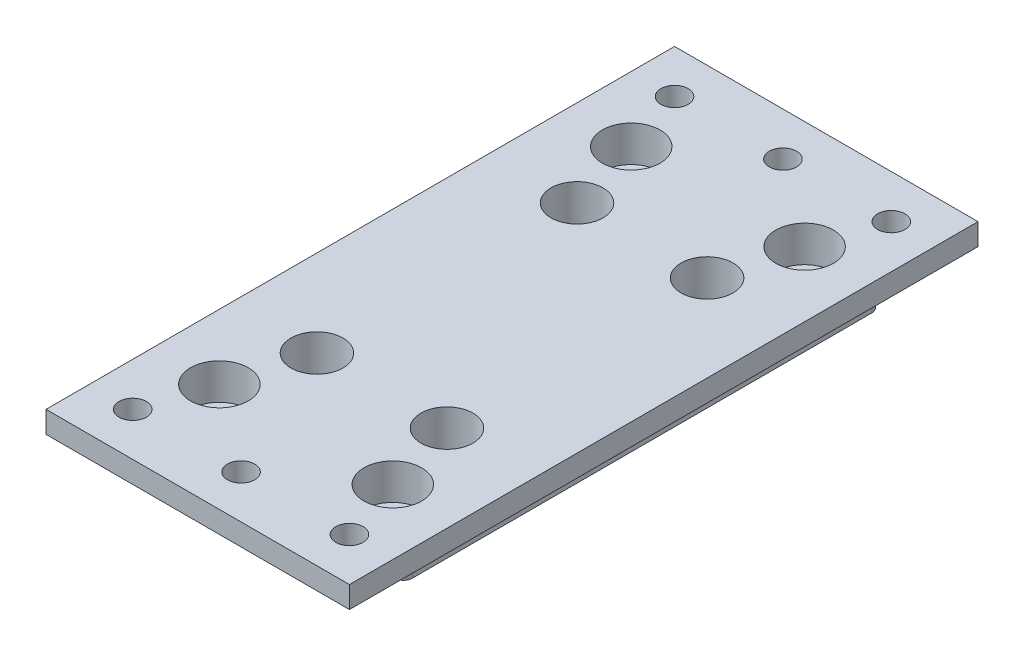
from build123d import *

# Parameters (mm, degrees)
SKETCH_1_R          = 4.1
SKETCH_1_R_2        = 6
EXTRUDE_1_DEPTH     = 11
SKETCH_2_R          = 6.65
CUT_EXTRUDE_1_DEPTH = 8.3
EXTRUDE_START       = -6
SKETCH_3_W          = 70
SKETCH_3_H          = 145
SKETCH_3_R          = 3.15
EXTRUDE_2_DEPTH     = 5


with BuildPart() as part:
    # 草图1 → 凸台-拉伸1 (new body)
    with BuildSketch(Plane(origin=(0, 0, 0), x_dir=(1, 0, 0), z_dir=(0, 1, 0))):
        with BuildLine():
            Line((-28, -55), (28, -55))
            ThreePointArc((28, -55), (29.414213562, -54.414213562), (30, -53))
            Line((30, -53), (30, 53))
            ThreePointArc((30, 53), (29.414213562, 54.414213562), (28, 55))
            Line((28, 55), (-28, 55))
            ThreePointArc((-28, 55), (-29.414213562, 54.414213562), (-30, 53))
            Line((-30, 53), (-30, -53))
            ThreePointArc((-30, -53), (-29.414213562, -54.414213562), (-28, -55))
        make_face()
        with Locations(Location((-20, 47.5, 0), (0, 0, 270))):
            Circle(SKETCH_1_R, mode=Mode.SUBTRACT)
        with Locations(Location((20, 47.5, 0), (0, 0, 90))):
            Circle(SKETCH_1_R, mode=Mode.SUBTRACT)
        with Locations(Location((-20, -47.5, 0), (0, 0, 90))):
            Circle(SKETCH_1_R, mode=Mode.SUBTRACT)
        with Locations(Location((20, -47.5, 0), (0, 0, 270))):
            Circle(SKETCH_1_R, mode=Mode.SUBTRACT)
        with Locations(Location((-15, 30, 0), (0, 0, 270))):
            Circle(SKETCH_1_R_2, mode=Mode.SUBTRACT)
        with Locations(Location((15, 30, 0), (0, 0, 90))):
            Circle(SKETCH_1_R_2, mode=Mode.SUBTRACT)
        with Locations(Location((15, -30, 0), (0, 0, 270))):
            Circle(SKETCH_1_R_2, mode=Mode.SUBTRACT)
        with Locations(Location((-15, -30, 0), (0, 0, 90))):
            Circle(SKETCH_1_R_2, mode=Mode.SUBTRACT)
    extrude(amount=EXTRUDE_1_DEPTH)

    # 草图2 → 切除-拉伸1 (cut)
    with BuildSketch(Plane(origin=(0, 11, 0), x_dir=(1, 0, 0), z_dir=(0, 1, 0))):
        with Locations(Location((-20, 47.5, 0), (0, 0, 270))):
            Circle(SKETCH_2_R)
        with Locations(Location((-20, -47.5, 0), (0, 0, 270))):
            Circle(SKETCH_2_R)
        with Locations(Location((20, 47.5, 0), (0, 0, 270))):
            Circle(SKETCH_2_R)
        with Locations(Location((20, -47.5, 0), (0, 0, 270))):
            Circle(SKETCH_2_R)
    extrude(amount=-CUT_EXTRUDE_1_DEPTH, mode=Mode.SUBTRACT)

    # 草图3 → 凸台-拉伸2 (add)
    with BuildSketch(Plane.XZ.offset(EXTRUDE_START)):
        Rectangle(SKETCH_3_W, SKETCH_3_H)
        with Locations(Location((-25, 62.5, 0), (0, 0, 270))):
            Circle(SKETCH_3_R, mode=Mode.SUBTRACT)
        with Locations(Location((25, 62.5, 0), (0, 0, 270))):
            Circle(SKETCH_3_R, mode=Mode.SUBTRACT)
        with Locations(Location((25, -62.5, 0), (0, 0, 270))):
            Circle(SKETCH_3_R, mode=Mode.SUBTRACT)
        with Locations(Location((-25, -62.5, 0), (0, 0, 270))):
            Circle(SKETCH_3_R, mode=Mode.SUBTRACT)
        with Locations(Location((0, 62.5, 0), (0, 0, 270))):
            Circle(SKETCH_3_R, mode=Mode.SUBTRACT)
        with Locations(Location((0, -62.5, 0), (0, 0, 270))):
            Circle(SKETCH_3_R, mode=Mode.SUBTRACT)
        with BuildLine():
            Line((-30, 53), (-30, -53))
            ThreePointArc((-30, -53), (-29.414213562, -54.414213562), (-28, -55))
            Line((-28, -55), (28, -55))
            ThreePointArc((28, -55), (29.414213562, -54.414213562), (30, -53))
            Line((30, -53), (30, 53))
            ThreePointArc((30, 53), (29.414213562, 54.414213562), (28, 55))
            Line((28, 55), (-28, 55))
            ThreePointArc((-28, 55), (-29.414213562, 54.414213562), (-30, 53))
        make_face(mode=Mode.SUBTRACT)
    extrude(amount=-EXTRUDE_2_DEPTH)


solid = part.part
